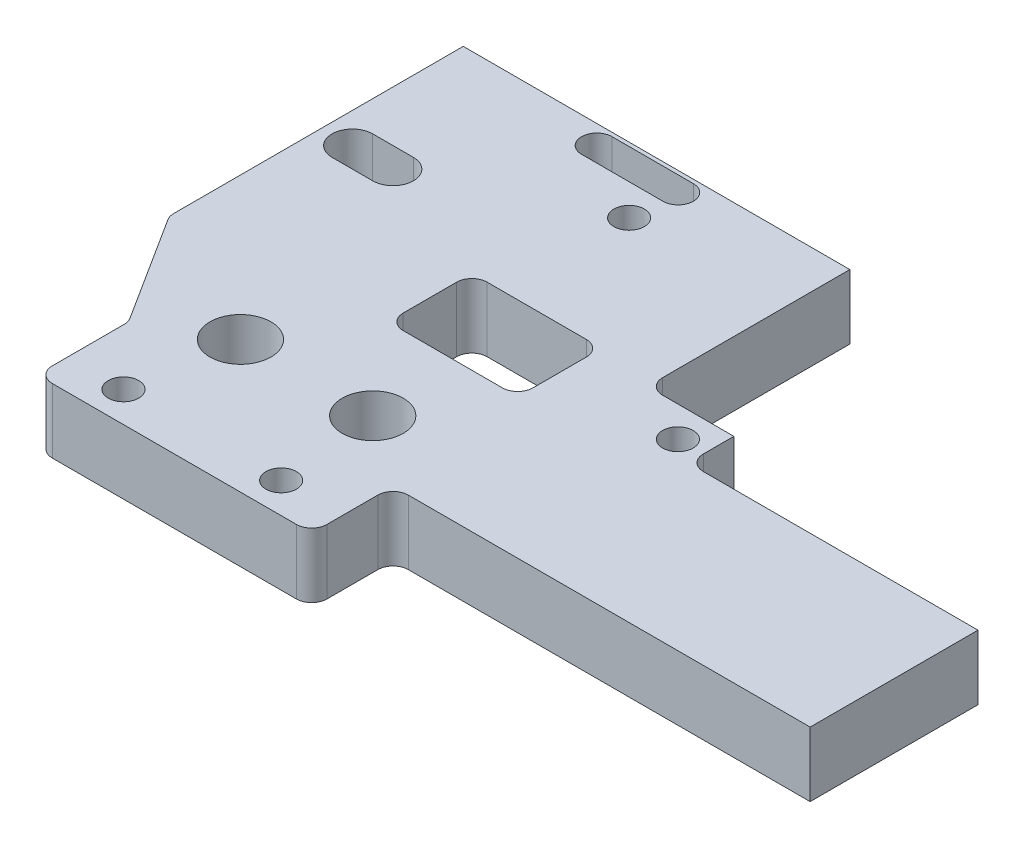
from build123d import *

# Parameters (mm, degrees)
SKETCH1_R               = 1.5
SKETCH1_R_2             = 3
SKETCH1_R_3             = 2
SKETCH1_W               = 12.75
SKETCH1_H               = 8.25
BOSS_EXTRUDE1_DEPTH     = 6.35
FILLET1_R               = 1.5
SKETCH3_W               = 129.678218063
SKETCH3_H               = 13.276015012
CUT_EXTRUDE1_DEPTH      = 56
SKETCH4_W               = 14.25
SKETCH4_H               = 6.35
SKETCH4_W_2             = 20.25
SKETCH4_W_3             = 16.5
BOSS_EXTRUDE2_DEPTH     = 25
SKETCH5_W               = 158.83803675
SKETCH5_H               = 69.224935419
CUT_EXTRUDE2_DEPTH      = 86
CUT_EXTRUDE3_DEPTH      = 10
CUT_EXTRUDE3_DEPTH_BACK = 49
SKETCH6_W               = 0.1
SKETCH6_H               = 6.35
SKETCH7_W               = 88.464513538
SKETCH7_H               = 23.115624737
CUT_EXTRUDE4_DEPTH      = 84


with BuildPart() as part:
    # Sketch1 → Boss-Extrude1 (new body)
    with BuildSketch(Plane(origin=(0, 0, 0), x_dir=(1, 0, 0), z_dir=(0, 1, 0))):
        Polygon((0, 20), (0, 104), (12, 104), (14, 93), (26, 93), (26, 107), (33.5, 114), (62.5, 114), (70, 107), (70, 93), (82, 93), (84, 104), (96, 104), (96, 20), (89, 9), (89, 0), (62, 0), (62, 8), (34, 8), (34, 0), (7, 0), (7, 9), align=None)
        with Locations(Location((12.5, 3, 0), (0, 0, 270))):
            Circle(SKETCH1_R, mode=Mode.SUBTRACT)
        with Locations(Location((28, 3, 0), (0, 0, 270))):
            Circle(SKETCH1_R, mode=Mode.SUBTRACT)
        with Locations(Location((68, 3, 0), (0, 0, 90))):
            Circle(SKETCH1_R, mode=Mode.SUBTRACT)
        with Locations(Location((83.5, 3, 0), (0, 0, 90))):
            Circle(SKETCH1_R, mode=Mode.SUBTRACT)
        with Locations(Location((14, 13, 0), (0, 0, 270))):
            Circle(SKETCH1_R_2, mode=Mode.SUBTRACT)
        with Locations(Location((27, 13, 0), (0, 0, 270))):
            Circle(SKETCH1_R_2, mode=Mode.SUBTRACT)
        with Locations(Location((69, 13, 0), (0, 0, 90))):
            Circle(SKETCH1_R_2, mode=Mode.SUBTRACT)
        with Locations(Location((82, 13, 0), (0, 0, 90))):
            Circle(SKETCH1_R_2, mode=Mode.SUBTRACT)
        with Locations(Location((22.75, 42.455027657, 0), (0, 0, 270))):
            Circle(SKETCH1_R, mode=Mode.SUBTRACT)
        with Locations(Location((22.75, 51.751081058, 0), (0, 0, 270))):
            Circle(SKETCH1_R, mode=Mode.SUBTRACT)
        with Locations(Location((73.25, 42.455027657, 0), (0, 0, 90))):
            Circle(SKETCH1_R, mode=Mode.SUBTRACT)
        with Locations(Location((73.25, 51.751081058, 0), (0, 0, 90))):
            Circle(SKETCH1_R, mode=Mode.SUBTRACT)
        with Locations(Location((18, 72.75, 0), (0, 0, 270))):
            Circle(SKETCH1_R, mode=Mode.SUBTRACT)
        with Locations(Location((28, 65.75, 0), (0, 0, 270))):
            Circle(SKETCH1_R, mode=Mode.SUBTRACT)
        with Locations(Location((68, 65.75, 0), (0, 0, 90))):
            Circle(SKETCH1_R, mode=Mode.SUBTRACT)
        with Locations(Location((78, 72.75, 0), (0, 0, 90))):
            Circle(SKETCH1_R, mode=Mode.SUBTRACT)
        with Locations(Location((36.5, 76.75, 0), (0, 0, 270))):
            Circle(SKETCH1_R_3, mode=Mode.SUBTRACT)
        with Locations(Location((59.5, 76.75, 0), (0, 0, 90))):
            Circle(SKETCH1_R_3, mode=Mode.SUBTRACT)
        with Locations(Location((35.5, 89, 0), (0, 0, 270))):
            Circle(SKETCH1_R, mode=Mode.SUBTRACT)
        with Locations(Location((35.5, 106.5, 0), (0, 0, 270))):
            Circle(SKETCH1_R, mode=Mode.SUBTRACT)
        with Locations(Location((60.5, 89, 0), (0, 0, 90))):
            Circle(SKETCH1_R, mode=Mode.SUBTRACT)
        with Locations(Location((60.5, 106.5, 0), (0, 0, 90))):
            Circle(SKETCH1_R, mode=Mode.SUBTRACT)
        with Locations(Location((44, 26, 0), (0, 0, 270))):
            Circle(SKETCH1_R, mode=Mode.SUBTRACT)
        with Locations(Location((52, 26, 0), (0, 0, 90))):
            Circle(SKETCH1_R, mode=Mode.SUBTRACT)
        with Locations(Location((52, 74, 0), (0, 0, 270))):
            Circle(SKETCH1_R, mode=Mode.SUBTRACT)
        with Locations(Location((44, 74, 0), (0, 0, 90))):
            Circle(SKETCH1_R, mode=Mode.SUBTRACT)
        with Locations(Location((48, 97.75, 0), (0, 0, 270))):
            Circle(SKETCH1_R_3, mode=Mode.SUBTRACT)
        with Locations((69.875, 25.875)):
            Rectangle(SKETCH1_W, SKETCH1_H, mode=Mode.SUBTRACT)
        with Locations((26.125, 25.875)):
            Rectangle(SKETCH1_W, SKETCH1_H, mode=Mode.SUBTRACT)
        with Locations((69.875, 81.875)):
            Rectangle(SKETCH1_W, SKETCH1_H, mode=Mode.SUBTRACT)
        with Locations((26.125, 81.875)):
            Rectangle(SKETCH1_W, SKETCH1_H, mode=Mode.SUBTRACT)
        with BuildLine():
            Line((3, 75), (7, 75))
            ThreePointArc((7, 75), (9, 73), (7, 71))
            Line((7, 71), (3, 71))
            ThreePointArc((3, 71), (1, 73), (3, 75))
        make_face(mode=Mode.SUBTRACT)
        with BuildLine():
            Line((93, 75), (89, 75))
            ThreePointArc((89, 75), (87, 73), (89, 71))
            Line((89, 71), (93, 71))
            ThreePointArc((93, 71), (95, 73), (93, 75))
        make_face(mode=Mode.SUBTRACT)
        with BuildLine():
            Line((93, 37), (89, 37))
            ThreePointArc((89, 37), (87, 35), (89, 33))
            Line((89, 33), (93, 33))
            ThreePointArc((93, 33), (95, 35), (93, 37))
        make_face(mode=Mode.SUBTRACT)
        with BuildLine():
            Line((3, 33), (7, 33))
            ThreePointArc((7, 33), (9, 35), (7, 37))
            Line((7, 37), (3, 37))
            ThreePointArc((3, 37), (1, 35), (3, 33))
        make_face(mode=Mode.SUBTRACT)
        with BuildLine():
            Line((15, 48.525154469), (23, 48.525154469))
            ThreePointArc((23, 48.525154469), (24.5, 47.025154469), (23, 45.525154469))
            Line((23, 45.525154469), (15, 45.525154469))
            ThreePointArc((15, 45.525154469), (13.5, 47.025154469), (15, 48.525154469))
        make_face(mode=Mode.SUBTRACT)
        with BuildLine():
            Line((81, 48.525154469), (73, 48.525154469))
            ThreePointArc((73, 48.525154469), (71.5, 47.025154469), (73, 45.525154469))
            Line((73, 45.525154469), (81, 45.525154469))
            ThreePointArc((81, 45.525154469), (82.5, 47.025154469), (81, 48.525154469))
        make_face(mode=Mode.SUBTRACT)
        with BuildLine():
            Line((16.5, 67.75), (16.5, 57.75))
            ThreePointArc((16.5, 57.75), (18, 56.25), (19.5, 57.75))
            Line((19.5, 57.75), (19.5, 67.75))
            ThreePointArc((19.5, 67.75), (18, 69.25), (16.5, 67.75))
        make_face(mode=Mode.SUBTRACT)
        with BuildLine():
            Line((76.5, 67.75), (76.5, 57.75))
            ThreePointArc((76.5, 57.75), (78, 56.25), (79.5, 57.75))
            Line((79.5, 57.75), (79.5, 67.75))
            ThreePointArc((79.5, 67.75), (78, 69.25), (76.5, 67.75))
        make_face(mode=Mode.SUBTRACT)
        with BuildLine():
            Line((46.5, 29), (38, 29))
            Line((38, 29), (38, 71))
            Line((38, 71), (46.5, 71))
            Line((46.5, 71), (46.5, 74))
            ThreePointArc((46.5, 74), (48, 75.5), (49.5, 74))
            Line((49.5, 74), (49.5, 71))
            Line((49.5, 71), (58, 71))
            Line((58, 71), (58, 29))
            Line((58, 29), (49.5, 29))
            Line((49.5, 29), (49.5, 26))
            ThreePointArc((49.5, 26), (48, 24.5), (46.5, 26))
            Line((46.5, 26), (46.5, 29))
        make_face(mode=Mode.SUBTRACT)
    extrude(amount=BOSS_EXTRUDE1_DEPTH)

    # Fillet1
    fillet1_edges = [part.edges().sort_by_distance(p)[0] for p in [
        (19.75, 3.175, -30),
        (19.75, 3.175, -21.75),
        (32.5, 3.175, -21.75),
        (32.5, 3.175, -30),
        (63.5, 3.175, -77.75),
        (76.25, 3.175, -77.75),
        (76.25, 3.175, -86),
        (63.5, 3.175, -86),
        (19.75, 3.175, -86),
        (19.75, 3.175, -77.75),
        (32.5, 3.175, -77.75),
        (32.5, 3.175, -86),
        (58, 3.175, -29),
        (58, 3.175, -71),
        (38, 3.175, -71),
        (38, 3.175, -29),
        (62, 3.175, -8),
        (34, 3.175, -8),
        (34, 3.175, 0),
        (7, 3.175, 0),
        (7, 3.175, -9),
        (0, 3.175, -20),
        (0, 3.175, -104),
        (12, 3.175, -104),
        (14, 3.175, -93),
        (26, 3.175, -93),
        (26, 3.175, -107),
        (33.5, 3.175, -114),
        (62.5, 3.175, -114),
        (70, 3.175, -107),
        (70, 3.175, -93),
        (82, 3.175, -93),
        (84, 3.175, -104),
        (96, 3.175, -104),
        (96, 3.175, -20),
        (89, 3.175, -9),
        (89, 3.175, 0),
        (62, 3.175, 0),
        (76.25, 3.175, -21.75),
        (76.25, 3.175, -30),
        (63.5, 3.175, -30),
        (63.5, 3.175, -21.75),
    ]]
    fillet(fillet1_edges, radius=FILLET1_R)

    # Sketch3 → Cut-Extrude1 (cut)
    with BuildSketch(Plane(origin=(48, 0, 0), x_dir=(0, 0, -1), z_dir=(1, 0, 0))):
        with Locations((58.42243018, 0.940732076)):
            Rectangle(SKETCH3_W, SKETCH3_H)
    extrude(amount=CUT_EXTRUDE1_DEPTH, mode=Mode.SUBTRACT)

    # Sketch4 → Boss-Extrude2 (add)
    with BuildSketch(Plane(origin=(48, 0, 0), x_dir=(0, 0, -1), z_dir=(1, 0, 0))):
        with Locations((106.875, 3.175)):
            Rectangle(SKETCH4_W, SKETCH4_H)
        with Locations((85.625, 3.175)):
            Rectangle(SKETCH4_W_2, SKETCH4_H)
        with Locations((16.25, 3.175)):
            Rectangle(SKETCH4_W_3, SKETCH4_H)
    extrude(amount=BOSS_EXTRUDE2_DEPTH)

    # Mirror1: part across plane


with BuildPart() as part_1:
    add(part.part)
    add(part.part.mirror(Plane(origin=(73, 0, 0), x_dir=(0, 0, 1), z_dir=(1, 0, 0))))

    # Sketch5 → Cut-Extrude2 (cut)
    with BuildSketch(Plane(origin=(75, 0, 0), x_dir=(0, 0, -1), z_dir=(1, 0, 0))):
        with Locations((54.73207584, 3.767679241)):
            Rectangle(SKETCH5_W, SKETCH5_H)
    extrude(amount=CUT_EXTRUDE2_DEPTH, mode=Mode.SUBTRACT)

    # Sketch6 → Cut-Extrude3 (cut, two sides: drawn at the far end of the back side and taken through both)
    with BuildSketch(Plane(origin=(38, 0, 0), x_dir=(0, 0, -1), z_dir=(1, 0, 0)).offset(-CUT_EXTRUDE3_DEPTH_BACK)):
        with Locations((48.95, 3.175)):
            Rectangle(SKETCH6_W, SKETCH6_H)
    extrude(amount=CUT_EXTRUDE3_DEPTH + CUT_EXTRUDE3_DEPTH_BACK, mode=Mode.SUBTRACT)


with BuildPart() as cut_extrude3_piece_1:
    # of the separate pieces the step leaves, piece 1, a body of its own (cut_extrude3_pieces)
    add(part_1.part.solids().sort_by_distance((0, 0, -49))[0])

    # Sketch7 → Cut-Extrude4 (cut)
    with BuildSketch(Plane(origin=(0, 0, -48.91), x_dir=(-1, 0, 0), z_dir=(0, 0, -1))):
        with Locations((-38.621683349, 5.173992705)):
            Rectangle(SKETCH7_W, SKETCH7_H)
    extrude(amount=CUT_EXTRUDE4_DEPTH, mode=Mode.SUBTRACT)


with BuildPart() as cut_extrude3_piece_2:
    # of the separate pieces the step leaves, piece 2, a body of its own (cut_extrude3_pieces)
    add(part_1.part.solids().sort_by_distance((0, 0, -20.436801031))[0])


solid = cut_extrude3_piece_2.part
